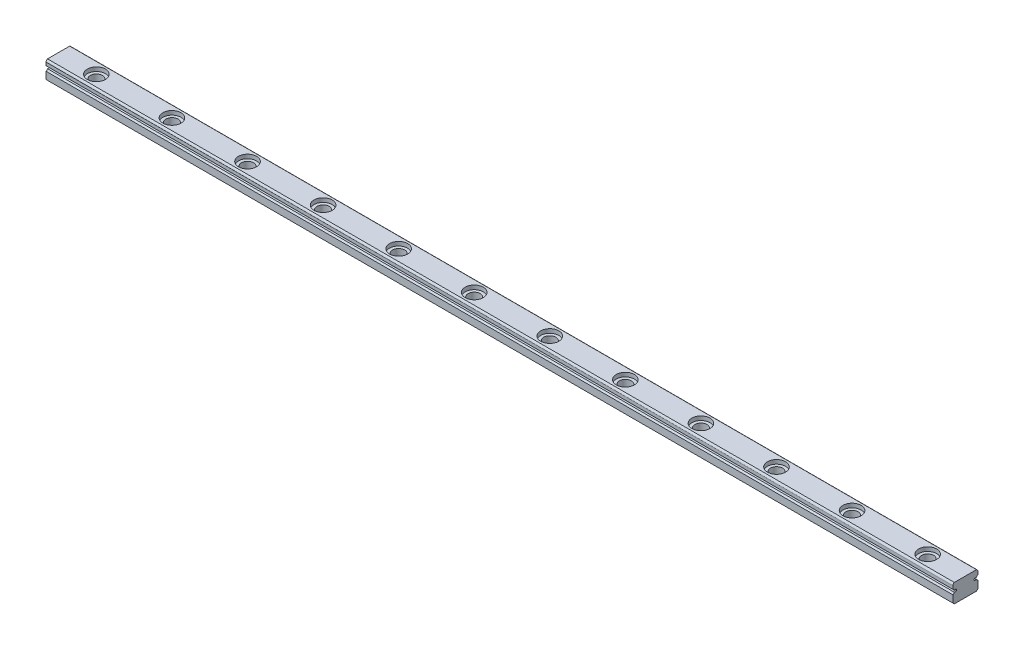
from build123d import *

# Parameters (mm, degrees)
EXTRUDE1_DEPTH  = 180
LPATTERN1_COUNT = 11
LPATTERN1_PITCH = 15


with BuildPart() as part:
    # Sketch1 → Extrude1 (new body)
    with BuildSketch(Plane(origin=(0, 0, 0), x_dir=(0, 0, -1), z_dir=(1, 0, 0))):
        with BuildLine():
            Line((-2.5, 0.3), (-2.2, 0))
            Line((-2.2, 0), (2.2, 0))
            Line((2.2, 0), (2.5, 0.3))
            Line((2.5, 0.3), (2.5, 1.723030399))
            ThreePointArc((2.5, 1.723030399), (2.315825857, 1.828075757), (2.191742431, 2))
            Line((2.191742431, 2), (1.85, 2))
            ThreePointArc((1.85, 2), (1.779289322, 2.029289322), (1.75, 2.1))
            Line((1.75, 2.1), (1.75, 2.3))
            ThreePointArc((1.75, 2.3), (1.779289322, 2.370710678), (1.85, 2.4))
            Line((1.85, 2.4), (2.191742431, 2.4))
            ThreePointArc((2.191742431, 2.4), (2.315825857, 2.571924243), (2.5, 2.676969601))
            Line((2.5, 2.676969601), (2.5, 3.3))
            ThreePointArc((2.5, 3.3), (2.393651515, 3.532738637), (2.2, 3.7))
            Line((2.2, 3.7), (-2.2, 3.7))
            ThreePointArc((-2.2, 3.7), (-2.393651515, 3.532738637), (-2.5, 3.3))
            Line((-2.5, 3.3), (-2.5, 2.676969601))
            ThreePointArc((-2.5, 2.676969601), (-2.315825857, 2.571924243), (-2.191742431, 2.4))
            Line((-2.191742431, 2.4), (-1.85, 2.4))
            ThreePointArc((-1.85, 2.4), (-1.779289322, 2.370710678), (-1.75, 2.3))
            Line((-1.75, 2.3), (-1.75, 2.1))
            ThreePointArc((-1.75, 2.1), (-1.779289322, 2.029289322), (-1.85, 2))
            Line((-1.85, 2), (-2.191742431, 2))
            ThreePointArc((-2.191742431, 2), (-2.315825857, 1.828075757), (-2.5, 1.723030399))
            Line((-2.5, 1.723030399), (-2.5, 0.3))
        make_face()
    extrude(amount=EXTRUDE1_DEPTH)

    # Sketch2 → Cut-Revolve1 (revolve, cut)
    with BuildSketch(Plane(origin=(0, 0, 0), x_dir=(-1, 0, 0), z_dir=(0, 0, -1))):
        Polygon((-7.5, 3.7), (-5.7, 3.7), (-5.7, 2.9), (-6.3, 2.9), (-6.3, 0.2), (-6.1, 0), (-7.5, 0), align=None)
    revolve(axis=Axis((7.5, 0, 0), (0, 1, 0)), mode=Mode.SUBTRACT)

    # Sketch3 → Cut-Revolve2 (revolve, cut)
    with BuildSketch(Plane(origin=(45, 0, 0), x_dir=(-1, 0, 0), z_dir=(0, 0, -1))):
        Polygon((-127.5, 3.7), (-125.7, 3.7), (-125.7, 2.9), (-126.3, 2.9), (-126.3, 0.2), (-126.1, 0), (-127.5, 0), align=None)
    cut_revolve2 = revolve(axis=Axis((172.5, 0, 0), (0, 1, 0)), mode=Mode.SUBTRACT)

    # LPattern1: Cut-Revolve2 ×11
    with Locations(*[(-i * LPATTERN1_PITCH, 0, 0) for i in range(1, LPATTERN1_COUNT)]):
        add(cut_revolve2, mode=Mode.SUBTRACT)


solid = part.part
